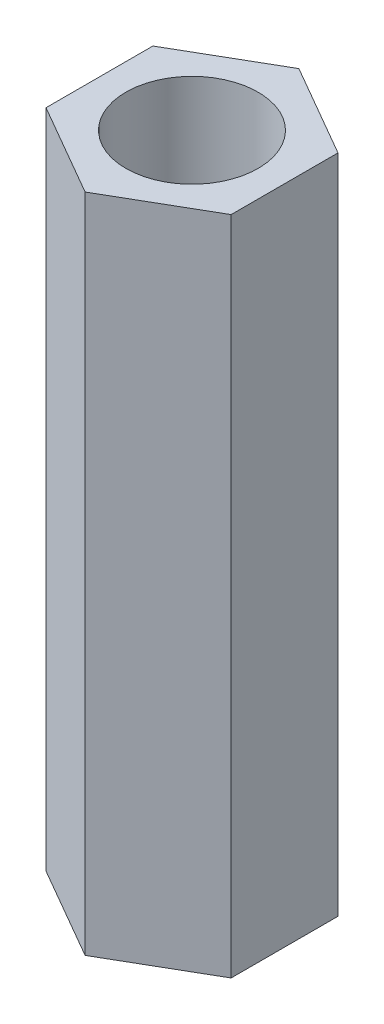
from build123d import *

# Parameters (mm, degrees)
SKETCH_1_R      = 1
EXTRUDE_1_DEPTH = 10


with BuildPart() as part:
    # 草图1 → 凸台-拉伸1 (new body)
    with BuildSketch(Plane(origin=(0, 0, 0), x_dir=(1, 0, 0), z_dir=(0, 1, 0))):
        Polygon((0, 1.616580754), (-1.4, 0.808290377), (-1.4, -0.808290377), (0, -1.616580754), (1.4, -0.808290377), (1.4, 0.808290377), align=None)
        with Locations(Location((0, 0, 0), (0, 0, 270))):
            Circle(SKETCH_1_R, mode=Mode.SUBTRACT)
    extrude(amount=EXTRUDE_1_DEPTH)


solid = part.part
